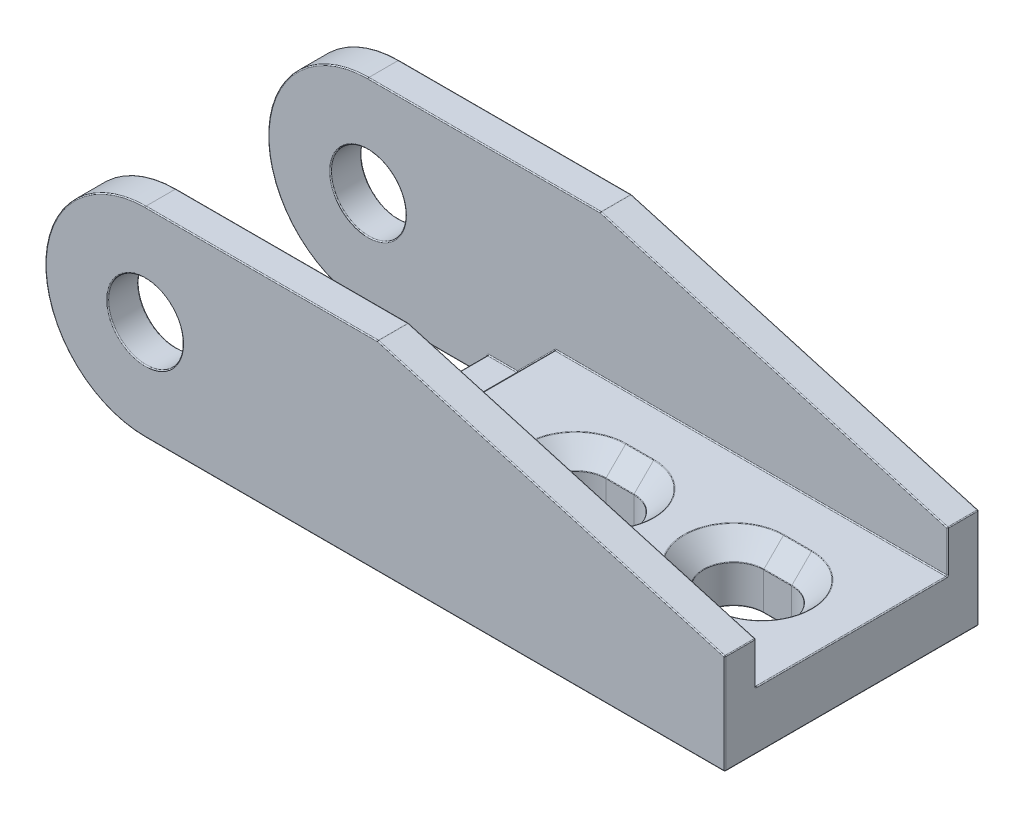
from build123d import *

# Parameters (mm, degrees)
SKETCH1_W           = 23
SKETCH1_H           = 9.6
BOSS_EXTRUDE1_DEPTH = 2.9
CHAMFER1_SIZE       = 1
CUT_EXTRUDE1_DEPTH  = 16.258440287
SKETCH2_R           = 1.875
BOSS_EXTRUDE2_DEPTH = 1.55
FILLET1_R           = 0.05


with BuildPart() as part:
    # Sketch1 → Boss-Extrude1 (new body)
    with BuildSketch(Plane(origin=(0, 0, 0), x_dir=(1, 0, 0), z_dir=(0, 1, 0))):
        Rectangle(SKETCH1_W, SKETCH1_H)
        with BuildLine():
            Line((5.6, 1.5), (7, 1.5))
            ThreePointArc((7, 1.5), (8.5, 0), (7, -1.5))
            Line((7, -1.5), (5.6, -1.5))
            ThreePointArc((5.6, -1.5), (4.1, 0), (5.6, 1.5))
        make_face(mode=Mode.SUBTRACT)
        with BuildLine():
            Line((-2.3, 1.5), (-0.9, 1.5))
            ThreePointArc((-0.9, 1.5), (0.6, 0), (-0.9, -1.5))
            Line((-0.9, -1.5), (-2.3, -1.5))
            ThreePointArc((-2.3, -1.5), (-3.8, 0), (-2.3, 1.5))
        make_face(mode=Mode.SUBTRACT)
    extrude(amount=BOSS_EXTRUDE1_DEPTH)

    # Chamfer1
    chamfer1_edges = [part.edges().sort_by_distance(p)[0] for p in [
        (4.1, 2.9, 0),
        (6.3, 2.9, 1.5),
        (8.5, 2.9, 0),
        (6.3, 2.9, -1.5),
        (-3.8, 2.9, 0),
        (-1.6, 2.9, 1.5),
        (0.6, 2.9, 0),
        (-1.6, 2.9, -1.5),
    ]]
    chamfer(chamfer1_edges, length=CHAMFER1_SIZE)

    # Sketch4 → Cut-Extrude1 (cut, through all)
    with BuildSketch(Plane.XY.offset(4.8)):
        Polygon((-11.5, 1), (-10, 1), (-8.1, 2.9), (-11.5, 2.9), align=None)
    extrude(amount=-CUT_EXTRUDE1_DEPTH, mode=Mode.SUBTRACT)

    # Sketch2 → Boss-Extrude2 (add)
    with BuildSketch(Plane.XY.offset(4.8)):
        with BuildLine():
            Line((11.5, 0), (11.5, 5))
            Line((11.5, 5), (-5.864916731, 10))
            Line((-5.864916731, 10), (-17.5, 10))
            ThreePointArc((-17.5, 10), (-22.5, 5), (-17.5, 0))
            Line((-17.5, 0), (11.5, 0))
        make_face()
        with Locations(Location((-17.5, 5, 0), (0, 0, 180))):
            Circle(SKETCH2_R, mode=Mode.SUBTRACT)
    boss_extrude2 = extrude(amount=BOSS_EXTRUDE2_DEPTH)

    # Mirror1: Boss-Extrude2 across plane
    add(boss_extrude2.mirror(Plane.XY))

    # Fillet1
    fillet1_edges = [part.edges().sort_by_distance(p)[0] for p in [
        (-3, 0, -6.35),
        (-22.5, 5, -6.35),
        (-11.682458366, 10, -6.35),
        (2.817541634, 7.5, -6.35),
        (-5.864916731, 10, -5.575),
        (11.5, 2.5, -6.35),
        (11.5, 5, -5.575),
        (-15.625, 5, -6.35),
        (11.5, 3.95, -4.8),
        (2.817541634, 7.5, -4.8),
        (-11.682458366, 10, -4.8),
        (-22.5, 5, -4.8),
        (-14.5, 0, -4.8),
        (-15.625, 5, -4.8),
        (4.1, 0, 0),
        (6.3, 0, 1.5),
        (8.5, 0, 0),
        (6.3, 0, -1.5),
        (-3.8, 0, 0),
        (-1.6, 0, 1.5),
        (0.6, 0, 0),
        (-1.6, 0, -1.5),
        (4.1, 1.9, 0),
        (1.6, 2.9, 0),
        (-1.6, 2.9, -2.5),
        (-1.6, 2.9, 2.5),
        (-4.8, 2.9, 0),
        (9.5, 2.9, 0),
        (6.3, 2.9, -2.5),
        (6.3, 2.9, 2.5),
        (3.1, 2.9, 0),
        (6.3, 1.9, 1.5),
        (6.3, 1.9, -1.5),
        (8.5, 1.9, 0),
        (11.5, 2.9, 0),
        (-3.8, 1.9, 0),
        (-1.6, 1.9, 1.5),
        (-1.6, 1.9, -1.5),
        (0.6, 1.9, 0),
        (-11.5, 0, 0),
        (11.5, 0, 0),
        (1.7, 2.9, 4.8),
        (-11.5, 0.5, 4.8),
        (-11.5, 0.5, -4.8),
        (-11.5, 1, 0),
        (-9.05, 1.95, -4.8),
        (-8.1, 2.9, 0),
        (-10.75, 1, -4.8),
        (-10, 1, 0),
        (-10.75, 1, 4.8),
        (-9.05, 1.95, 4.8),
        (-3, 0, 6.35),
        (11.5, 2.5, 6.35),
        (2.817541634, 7.5, 6.35),
        (-11.682458366, 10, 6.35),
        (-22.5, 5, 6.35),
        (-15.625, 5, 4.8),
        (-14.5, 0, 4.8),
        (11.5, 3.95, 4.8),
        (2.817541634, 7.5, 4.8),
        (11.5, 5, 5.575),
        (-11.682458366, 10, 4.8),
        (-5.864916731, 10, 5.575),
        (-22.5, 5, 4.8),
        (-15.625, 5, 6.35),
        (1.7, 2.9, -4.8),
    ]]
    fillet(fillet1_edges, radius=FILLET1_R)


solid = part.part
